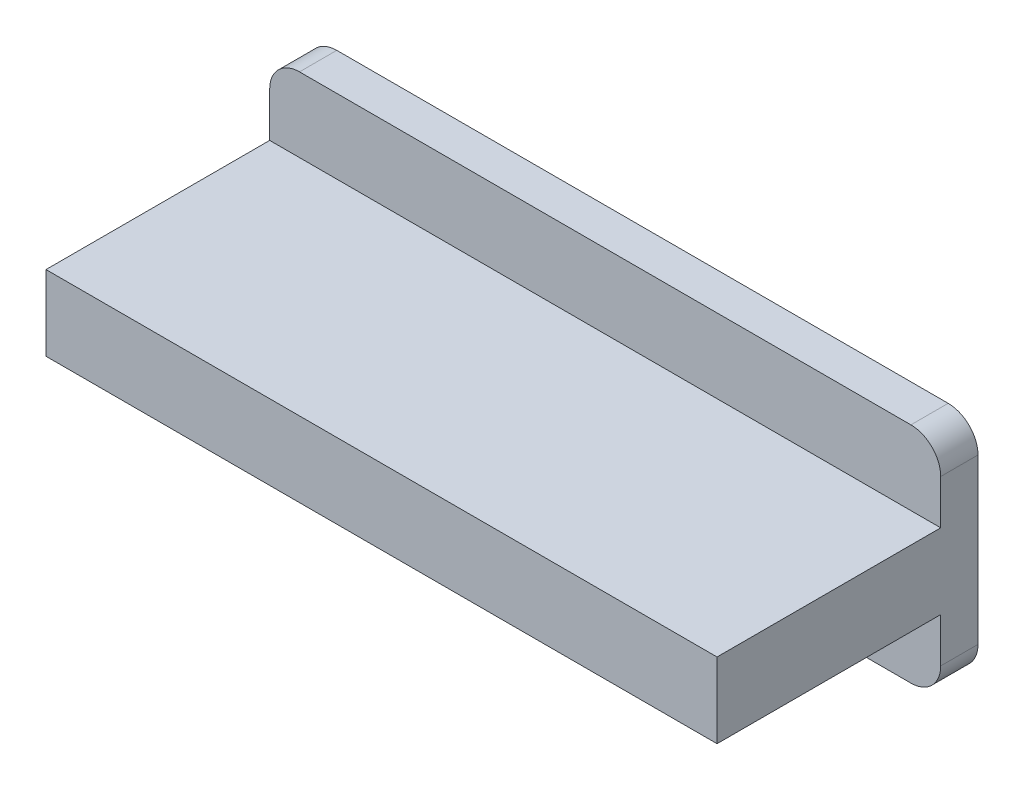
from build123d import *

# Parameters (mm, degrees)
SKETCH1_W           = 57.15
SKETCH1_H           = 19.05
BOSS_EXTRUDE1_DEPTH = 3.175
SKETCH2_W           = 57.15
SKETCH2_H           = 6.398717948
BOSS_EXTRUDE2_DEPTH = 19.05
FILLET1_R           = 2.54


with BuildPart() as part:
    # Sketch1 → Boss-Extrude1 (new body)
    with BuildSketch(Plane.XY):
        Rectangle(SKETCH1_W, SKETCH1_H)
    extrude(amount=BOSS_EXTRUDE1_DEPTH)

    # Sketch2 → Boss-Extrude2 (add)
    with BuildSketch(Plane.XY.offset(3.175)):
        Rectangle(SKETCH2_W, SKETCH2_H)
    extrude(amount=BOSS_EXTRUDE2_DEPTH)

    # Fillet1
    fillet1_edges = [part.edges().sort_by_distance(p)[0] for p in [
        (28.575, -9.525, 1.5875),
        (-28.575, -9.525, 1.5875),
        (-28.575, 9.525, 1.5875),
        (28.575, 9.525, 1.5875),
    ]]
    fillet(fillet1_edges, radius=FILLET1_R)


solid = part.part
